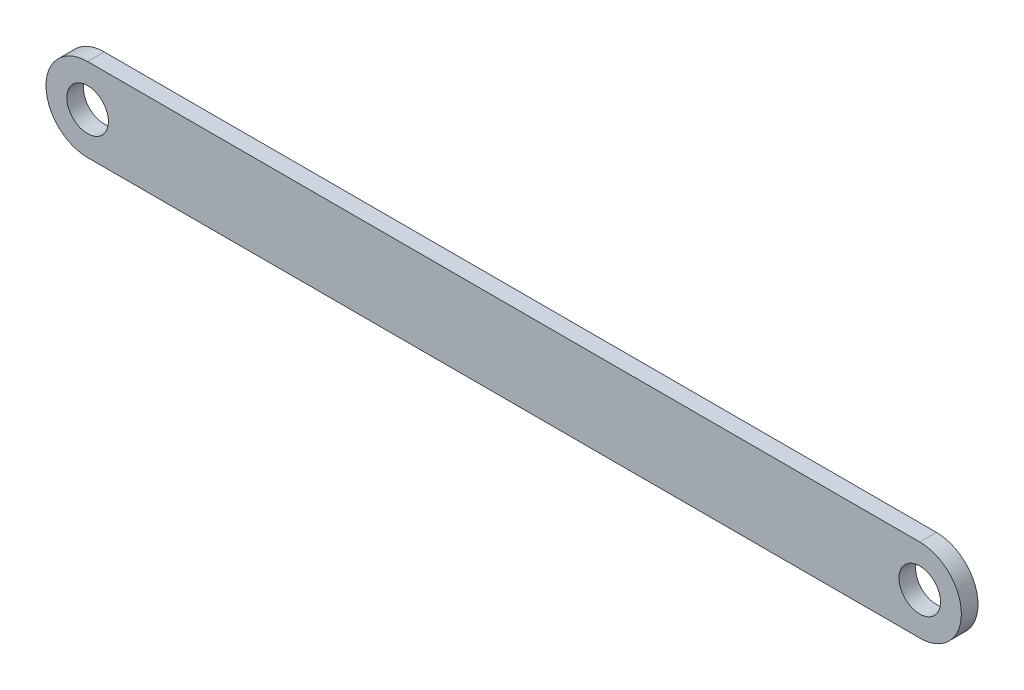
from build123d import *

# Parameters (mm, degrees)
SKETCH1_R           = 2.5
BOSS_EXTRUDE1_DEPTH = 2


with BuildPart() as part:
    # Sketch1 → Boss-Extrude1 (new body)
    with BuildSketch(Plane.XY):
        with BuildLine():
            Line((-52.442528736, 5), (47.557471264, 5))
            ThreePointArc((47.557471264, 5), (52.557471264, 0), (47.557471264, -5))
            Line((47.557471264, -5), (-52.442528736, -5))
            ThreePointArc((-52.442528736, -5), (-57.442528736, 0), (-52.442528736, 5))
        make_face()
        with Locations((-52.442528736, 0)):
            Circle(SKETCH1_R, mode=Mode.SUBTRACT)
        with Locations((47.557471264, 0)):
            Circle(SKETCH1_R, mode=Mode.SUBTRACT)
    extrude(amount=BOSS_EXTRUDE1_DEPTH)


solid = part.part
